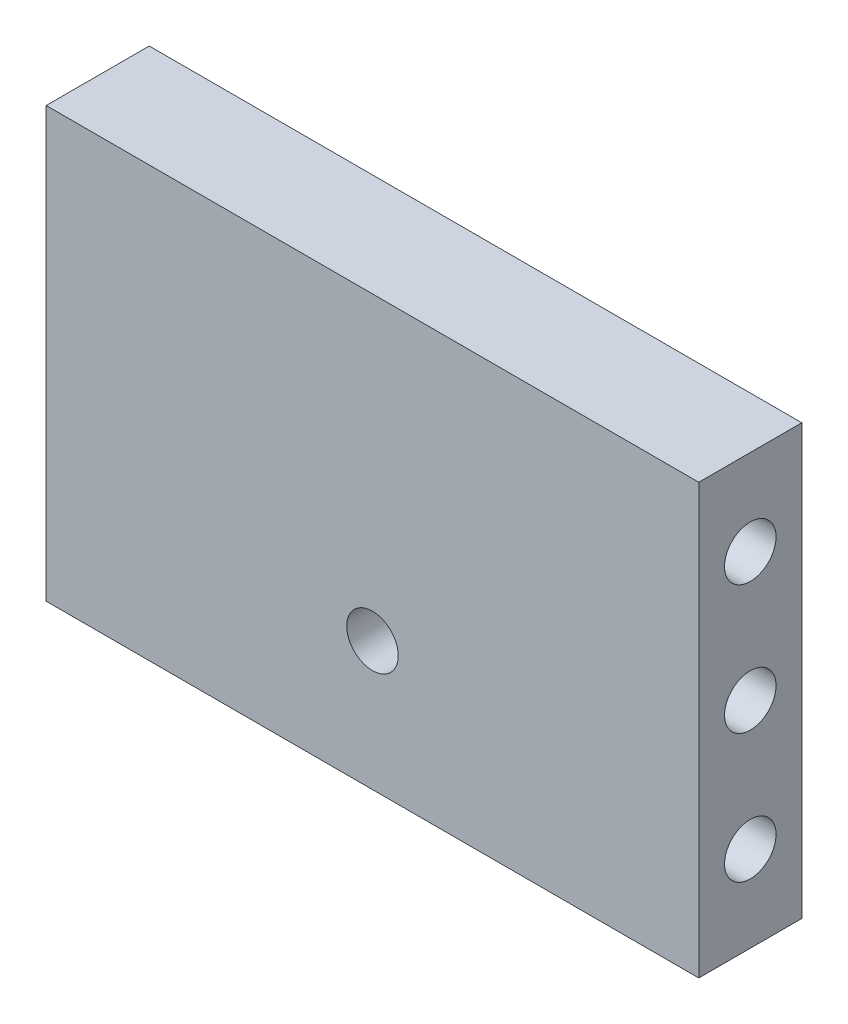
from build123d import *

# Parameters (mm, degrees)
SKETCH_1_W          = 76
SKETCH_1_H          = 50
EXTRUDE_1_DEPTH     = 12
SKETCH_2_R          = 3
CUT_EXTRUDE_1_DEPTH = 10
CUT_EXTRUDE_START   = -10
SKETCH_3_R          = 3
CUT_EXTRUDE_2_DEPTH = 10
SKETCH_4_R          = 3
CUT_EXTRUDE_3_DEPTH = 10
SKETCH_5_R          = 3
CUT_EXTRUDE_4_DEPTH = 12


with BuildPart() as part:
    # 草图1 → 凸台-拉伸1 (new body)
    with BuildSketch(Plane.XY):
        Rectangle(SKETCH_1_W, SKETCH_1_H)
    extrude(amount=EXTRUDE_1_DEPTH)

    # 草图2 → 切除-拉伸1 (cut)
    with BuildSketch(Plane.ZY.offset(38)):
        with Locations((6, -15)):
            Circle(SKETCH_2_R)
        with Locations((6, 0)):
            Circle(SKETCH_2_R)
        with Locations((6, 15)):
            Circle(SKETCH_2_R)
    extrude(amount=-CUT_EXTRUDE_1_DEPTH, mode=Mode.SUBTRACT)

    # 草图3 → 切除-拉伸2 (cut)
    with BuildSketch(Plane(origin=(38, 0, 0), x_dir=(0, 0, -1), z_dir=(1, 0, 0)).offset(CUT_EXTRUDE_START)):
        with Locations(Location((-6, -15, 0), (0, 0, 180))):
            Circle(SKETCH_3_R)
        with Locations(Location((-6, 0, 0), (0, 0, 180))):
            Circle(SKETCH_3_R)
        with Locations(Location((-6, 15, 0), (0, 0, 180))):
            Circle(SKETCH_3_R)
    extrude(amount=CUT_EXTRUDE_2_DEPTH, mode=Mode.SUBTRACT)

    # 草图4 → 切除-拉伸3 (cut)
    with BuildSketch(Plane.XZ.offset(25)):
        with Locations(Location((22.5, 6, 0), (0, 0, 270))):
            Circle(SKETCH_4_R)
        with Locations(Location((7.5, 6, 0), (0, 0, 270))):
            Circle(SKETCH_4_R)
        with Locations(Location((-7.5, 6, 0), (0, 0, 270))):
            Circle(SKETCH_4_R)
        with Locations(Location((-22.5, 6, 0), (0, 0, 270))):
            Circle(SKETCH_4_R)
    extrude(amount=-CUT_EXTRUDE_3_DEPTH, mode=Mode.SUBTRACT)

    # 草图5 → 切除-拉伸4 (cut)
    with BuildSketch(Plane(origin=(0, 0, 0), x_dir=(-1, 0, 0), z_dir=(0, 0, -1))):
        with Locations((0, -10)):
            Circle(SKETCH_5_R)
    extrude(amount=-CUT_EXTRUDE_4_DEPTH, mode=Mode.SUBTRACT)


solid = part.part
